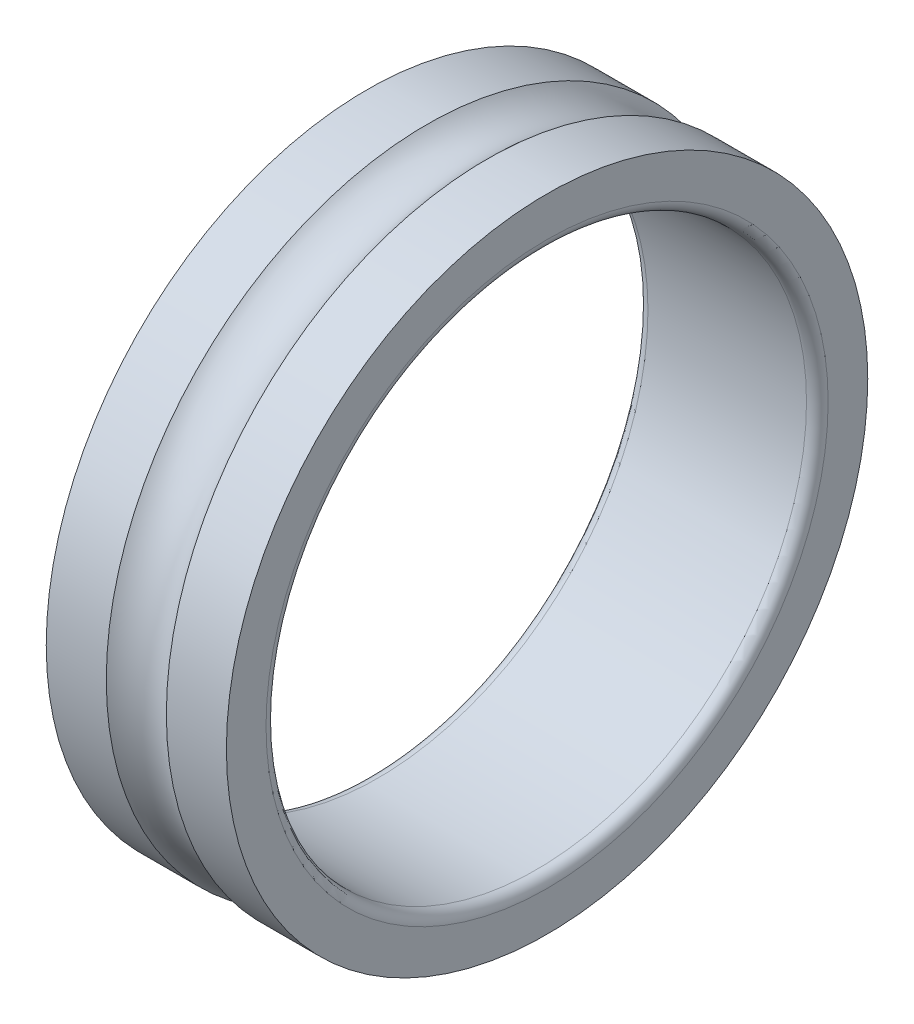
from build123d import *


with BuildPart() as part:
    # Sketch1 → Revolução1 (revolve)
    with BuildSketch(Plane.XY, mode=Mode.PRIVATE) as revolu_o1_sk:
        with BuildLine():
            Line((0.3, 7.5), (4.7, 7.5))
            ThreePointArc((4.7, 7.5), (4.912132034, 7.587867966), (5, 7.8))
            Line((5, 7.8), (5, 8.9))
            Line((5, 8.9), (3.333540791, 8.9))
            ThreePointArc((3.333540791, 8.9), (2.5, 8.5595), (1.666459209, 8.9))
            Line((1.666459209, 8.9), (0, 8.9))
            Line((0, 8.9), (0, 7.8))
            ThreePointArc((0, 7.8), (0.087867966, 7.587867966), (0.3, 7.5))
        make_face()
    revolve(revolu_o1_sk.sketch.rotate(Axis((50, 0, 0), (-1, 0, 0)), 270), axis=Axis((50, 0, 0), (-1, 0, 0)))


solid = part.part
